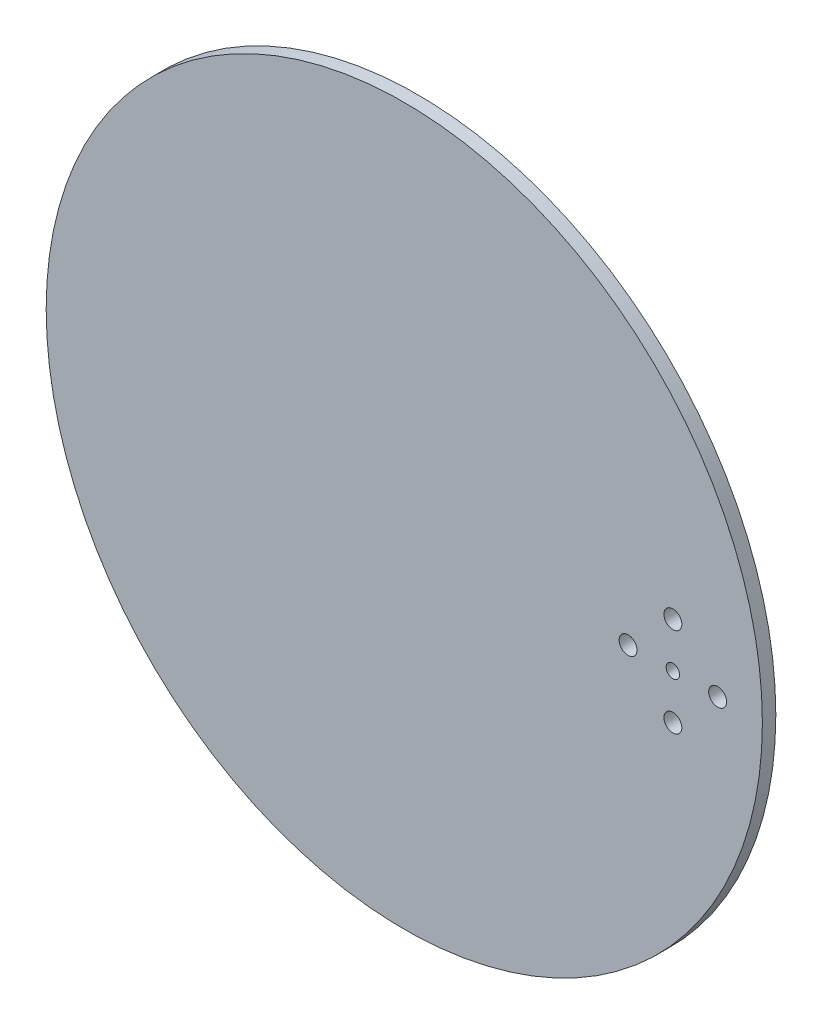
from build123d import *

# Parameters (mm, degrees)
SKETCH_1_R          = 80
EXTRUDE_1_DEPTH     = 3
SKETCH_2_R          = 2
SKETCH_2_R_2        = 1.5
CUT_EXTRUDE_4_DEPTH = 3


with BuildPart() as part:
    # 草图1 → 凸台-拉伸1 (new body)
    with BuildSketch(Plane.XY):
        Circle(SKETCH_1_R)
    extrude(amount=EXTRUDE_1_DEPTH)

    # 草图2 → 切除-拉伸4 (cut)
    with BuildSketch(Plane.XY.offset(3)):
        with Locations((70, 0)):
            Circle(SKETCH_2_R)
        with Locations((60, -10)):
            Circle(SKETCH_2_R)
        with Locations((60, 0)):
            Circle(SKETCH_2_R_2)
        with Locations((50, 0)):
            Circle(SKETCH_2_R)
        with Locations((60, 10)):
            Circle(SKETCH_2_R)
    extrude(amount=-CUT_EXTRUDE_4_DEPTH, mode=Mode.SUBTRACT)


solid = part.part
